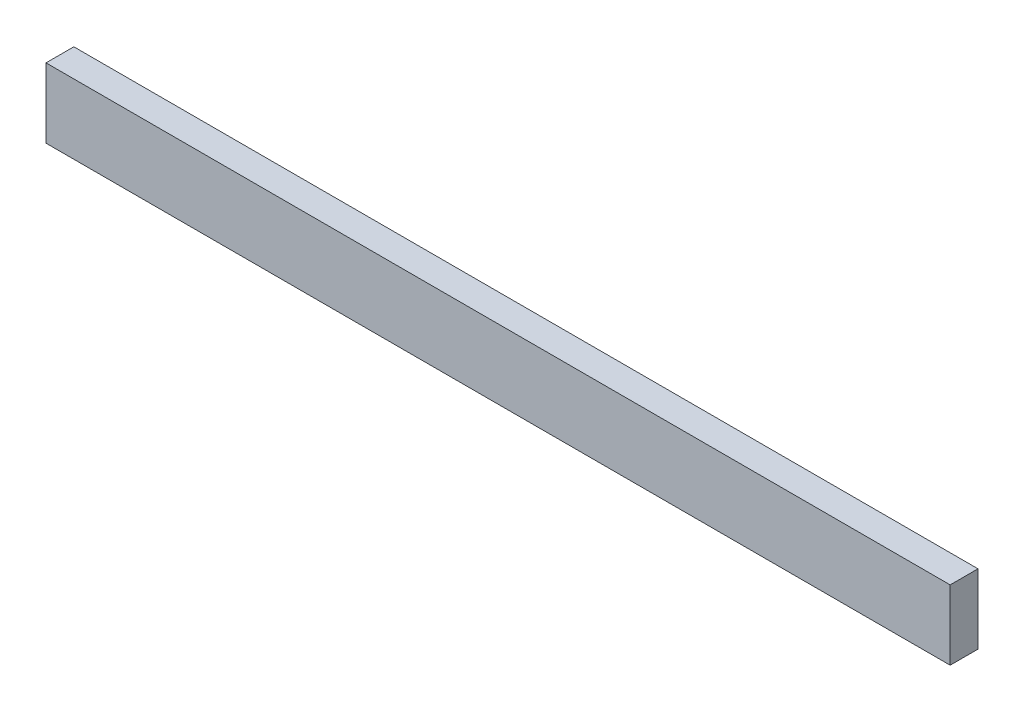
from build123d import *

# Parameters (mm, degrees)
SKETCH1_W           = 324.8
SKETCH1_H           = 25
BOSS_EXTRUDE1_DEPTH = 10


with BuildPart() as part:
    # Sketch1 → Boss-Extrude1 (new body)
    with BuildSketch(Plane.XY):
        with Locations((0, 12.5)):
            Rectangle(SKETCH1_W, SKETCH1_H)
    extrude(amount=BOSS_EXTRUDE1_DEPTH)


solid = part.part
